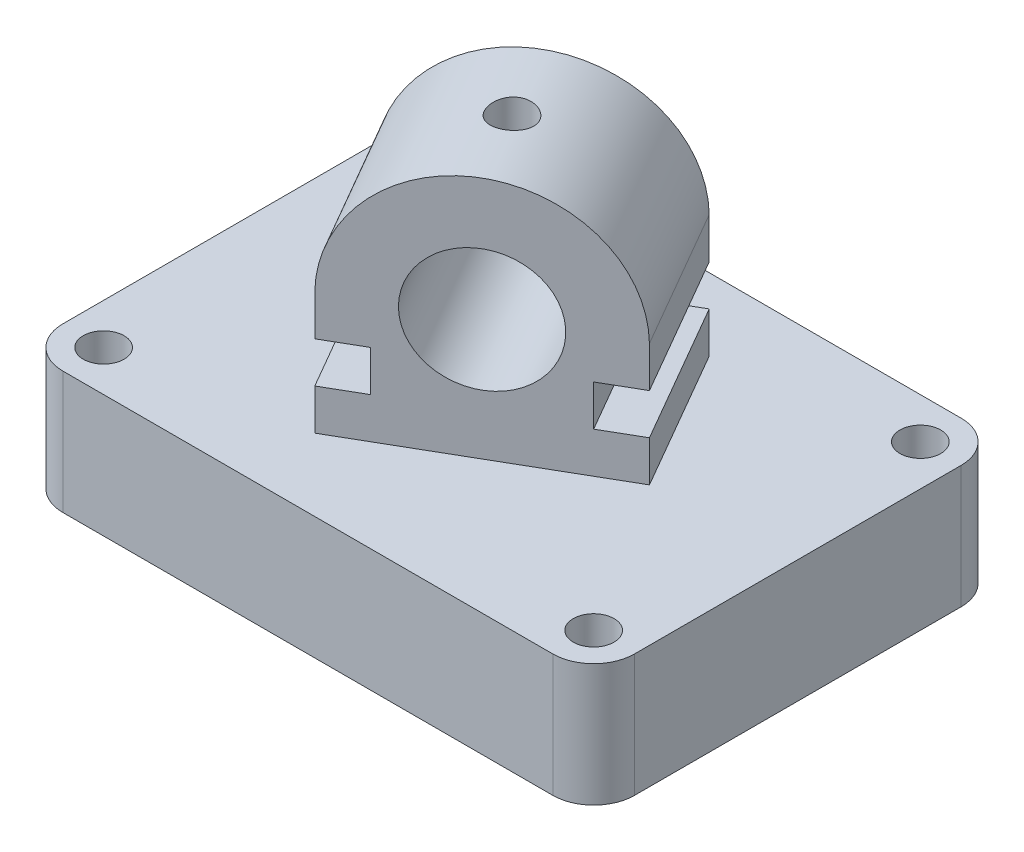
from build123d import *

# Parameters (mm, degrees)
SKETCH1_R           = 3.175
BOSS_EXTRUDE1_DEPTH = 19.05
SKETCH3_R           = 9.525
BOSS_EXTRUDE2_DEPTH = 12.7
SKETCH4_R           = 3.175
CUT_EXTRUDE1_DEPTH  = 67.599361859


with BuildPart() as part:
    # Sketch1 → Boss-Extrude1 (new body)
    with BuildSketch(Plane(origin=(0, 0, 0), x_dir=(1, 0, 0), z_dir=(0, 1, 0))):
        with BuildLine():
            Line((-38.1, 31.75), (38.1, 31.75))
            ThreePointArc((38.1, 31.75), (42.590128061, 29.890128061), (44.45, 25.4))
            Line((44.45, 25.4), (44.45, -25.4))
            ThreePointArc((44.45, -25.4), (42.590128061, -29.890128061), (38.1, -31.75))
            Line((38.1, -31.75), (-38.1, -31.75))
            ThreePointArc((-38.1, -31.75), (-42.590128061, -29.890128061), (-44.45, -25.4))
            Line((-44.45, -25.4), (-44.45, 25.4))
            ThreePointArc((-44.45, 25.4), (-42.590128061, 29.890128061), (-38.1, 31.75))
        make_face()
        with Locations((-38.1, 25.4)):
            Circle(SKETCH1_R, mode=Mode.SUBTRACT)
        with Locations((-38.1, -25.4)):
            Circle(SKETCH1_R, mode=Mode.SUBTRACT)
        with Locations((38.1, -25.4)):
            Circle(SKETCH1_R, mode=Mode.SUBTRACT)
        with Locations((38.1, 25.4)):
            Circle(SKETCH1_R, mode=Mode.SUBTRACT)
    extrude(amount=BOSS_EXTRUDE1_DEPTH)

    # Sketch3 → Boss-Extrude2 (add, symmetric)
    with BuildSketch(Plane(origin=(0, 0, 0), x_dir=(0, 1, 0), z_dir=(-0.500000000000001, 0, -0.866025403784438))):
        with BuildLine():
            Line((25.4, 19.048282487), (19.05, 19.048282487))
            Line((19.05, 19.048282487), (19.05, 17.120567884))
            Line((19.05, 17.120567884), (19.05, -19.048282487))
            Line((19.05, -19.048282487), (25.4, -19.048282487))
            Line((25.4, -19.048282487), (25.4, -12.698282487))
            Line((25.4, -12.698282487), (31.75, -12.698282487))
            Line((31.75, -12.698282487), (31.75, -19.048282487))
            Line((31.75, -19.048282487), (38.1, -19.048282487))
            ThreePointArc((38.1, -19.048282487), (56.894198738, 0), (38.1, 19.048282487))
            Line((38.1, 19.048282487), (31.75, 19.048282487))
            Line((31.75, 19.048282487), (31.75, 12.698282487))
            Line((31.75, 12.698282487), (25.4, 12.698282487))
            Line((25.4, 12.698282487), (25.4, 19.048282487))
        make_face()
        with Locations((37.844198738, 0)):
            Circle(SKETCH3_R, mode=Mode.SUBTRACT)
    extrude(amount=BOSS_EXTRUDE2_DEPTH, both=True)

    # Sketch4 → Cut-Extrude1 (cut, through all)
    with BuildSketch(Plane(origin=(0, 38.1, 0), x_dir=(1, 0, 0), z_dir=(0, 1, 0))):
        Circle(SKETCH4_R)
    extrude(amount=CUT_EXTRUDE1_DEPTH, mode=Mode.SUBTRACT)


solid = part.part
